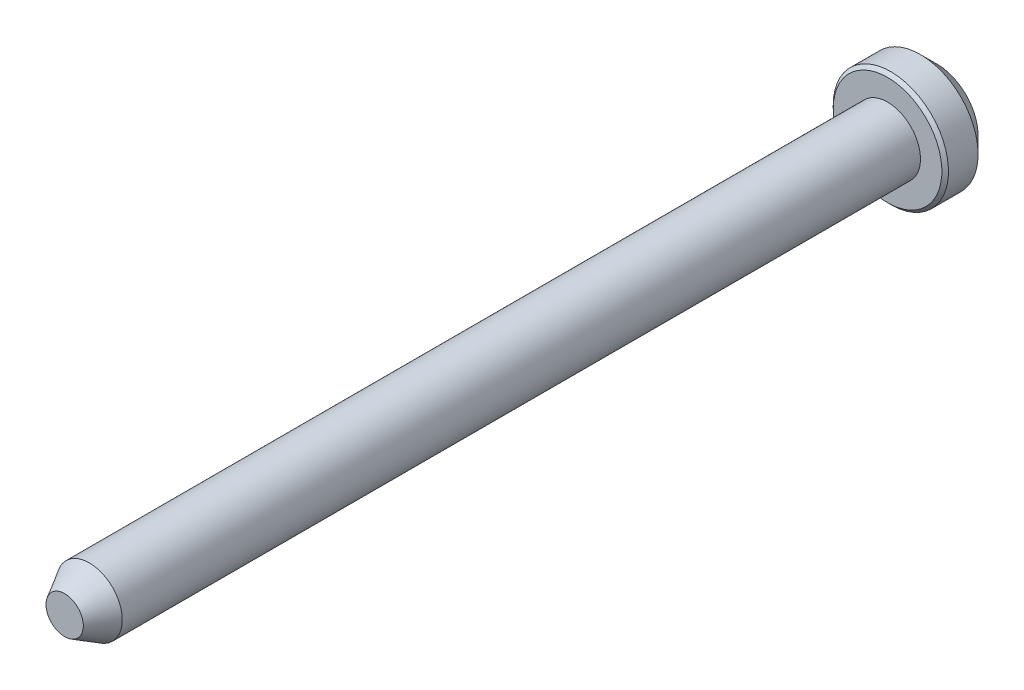
from build123d import *

# Parameters (mm, degrees)
CHAMFER1_SIZE = 0.2


with BuildPart() as part:
    # Sketch1 → Revolve1 (revolve)
    with BuildSketch(Plane(origin=(0, 0, 0), x_dir=(1, 0, 0), z_dir=(0, 1, 0)), mode=Mode.PRIVATE) as revolve1_sk:
        Polygon((0, 0), (0, 53), (2.5, 53), (3.5, 52), (3.5, 50), (2, 50), (2, 1.5), (1.133974596, 0), align=None)
    revolve(revolve1_sk.sketch.rotate(Axis((0, 0, 0), (0, 0, 1)), 180), axis=Axis((0, 0, 0), (0, 0, 1)))

    # Chamfer1
    chamfer1_edges = [part.edges().sort_by_distance(p)[0] for p in [
        (3.5, 0, -50),
    ]]
    chamfer(chamfer1_edges, length=CHAMFER1_SIZE)


solid = part.part
